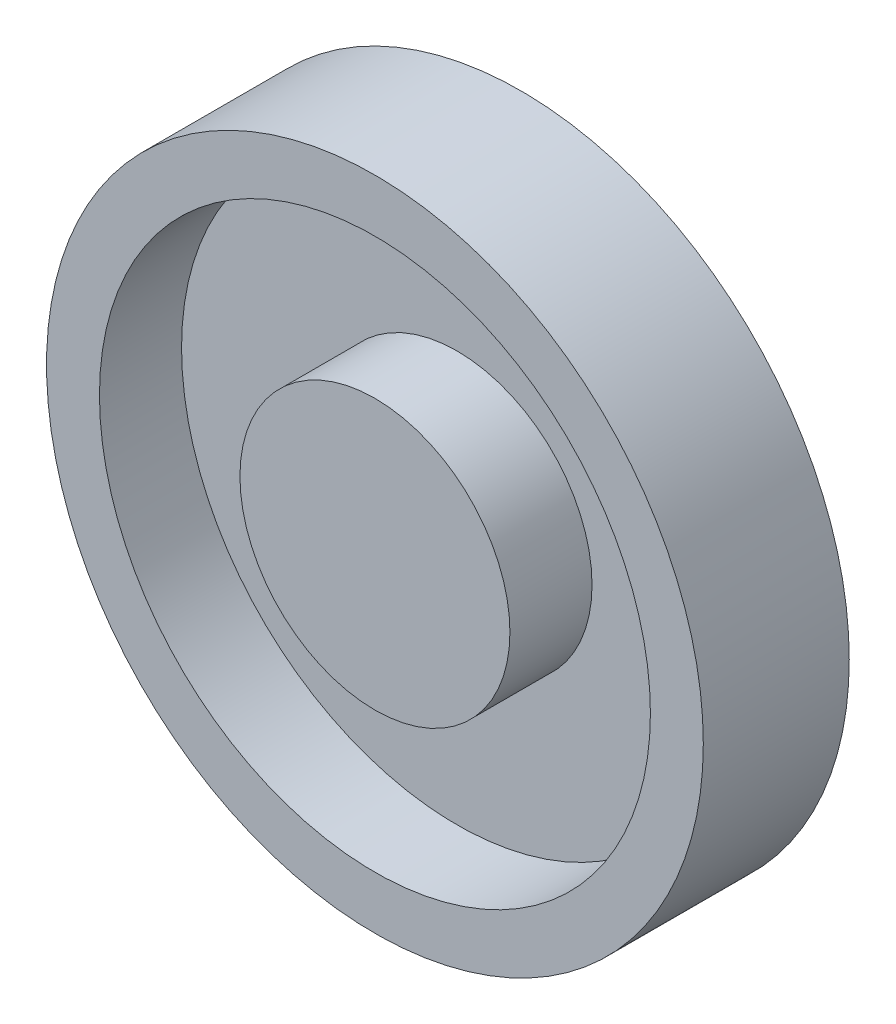
from build123d import *

# Parameters (mm, degrees)
SKETCH1_R           = 18
BOSS_EXTRUDE1_DEPTH = 8
SKETCH2_R           = 15.1
SKETCH2_R_2         = 7.4
CUT_EXTRUDE1_DEPTH  = 4.5


with BuildPart() as part:
    # Sketch1 → Boss-Extrude1 (new body)
    with BuildSketch(Plane.XY):
        Circle(SKETCH1_R)
    extrude(amount=BOSS_EXTRUDE1_DEPTH)

    # Sketch2 → Cut-Extrude1 (cut)
    with BuildSketch(Plane.XY.offset(8)):
        Circle(SKETCH2_R)
        Circle(SKETCH2_R_2, mode=Mode.SUBTRACT)
    extrude(amount=-CUT_EXTRUDE1_DEPTH, mode=Mode.SUBTRACT)


solid = part.part
